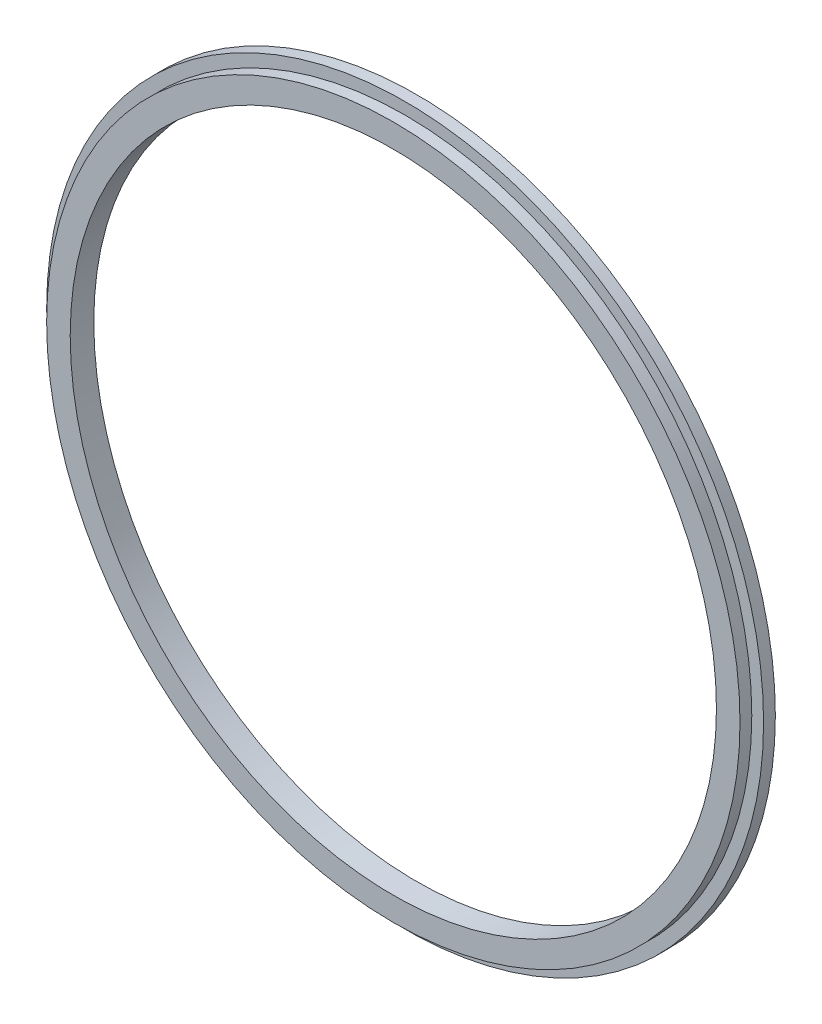
from build123d import *
from build123d.topology import SkipClean

# Parameters (mm, degrees)
SKETCH1_R           = 58.829
SKETCH1_R_2         = 54.829
BOSS_EXTRUDE1_DEPTH = 2
BOSS_EXTRUDE2_START = 2
SKETCH3_R           = 60.829
SKETCH3_R_2         = 54.829
BOSS_EXTRUDE2_DEPTH = 2


with BuildPart() as part:
    # Sketch1 → Boss-Extrude1 (new body)
    with BuildSketch(Plane.XY):
        Circle(SKETCH1_R)
        Circle(SKETCH1_R_2, mode=Mode.SUBTRACT)
    extrude(amount=BOSS_EXTRUDE1_DEPTH)

    # Sketch3 → Boss-Extrude2 (add)
    with SkipClean():  # the faces are left unmerged after this step: merging them gives an invalid solid
        with BuildSketch(Plane(origin=(0, 0, 0), x_dir=(-1, 0, 0), z_dir=(0, 0, -1)).offset(BOSS_EXTRUDE2_START)):
            Circle(SKETCH3_R)
            Circle(SKETCH3_R_2, mode=Mode.SUBTRACT)
        extrude(amount=-BOSS_EXTRUDE2_DEPTH)


solid = part.part
